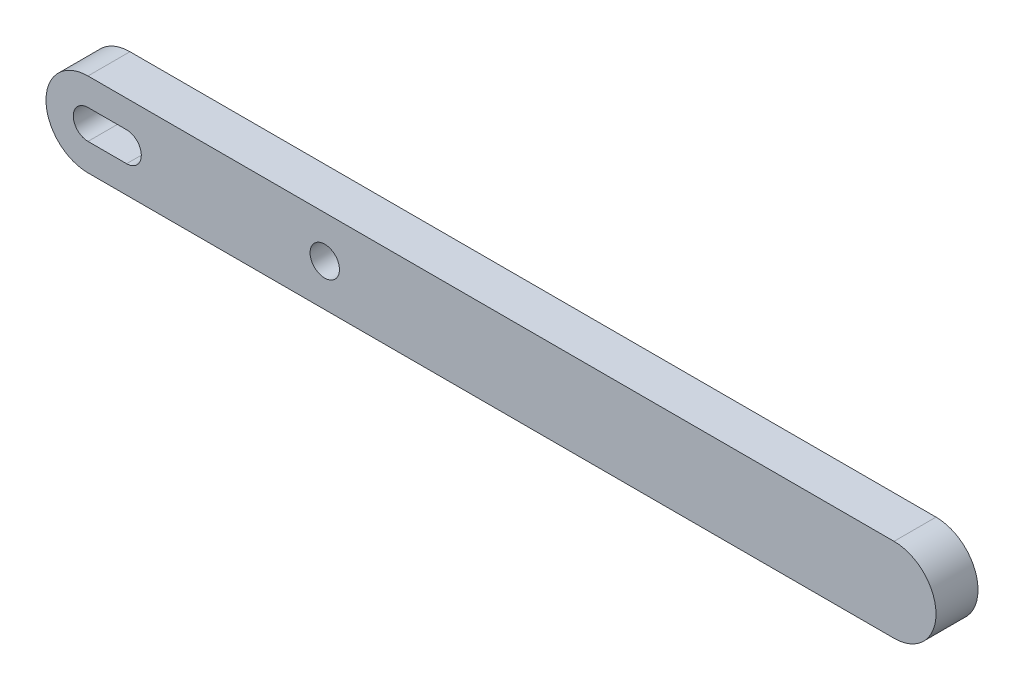
from build123d import *

# Parameters (mm, degrees)
SKETCH1_R           = 1.75
BOSS_EXTRUDE1_DEPTH = 5


with BuildPart() as part:
    # Sketch1 → Boss-Extrude1 (new body)
    with BuildSketch(Plane(origin=(0, 0, 0), x_dir=(0, 1, 0), z_dir=(0, 0, 1))):
        with BuildLine():
            Line((-5, 0), (-5, 96))
            ThreePointArc((-5, 96), (0, 101), (5, 96))
            Line((5, 96), (5, 0))
            ThreePointArc((5, 0), (0, -5), (-5, 0))
        make_face()
        with Locations(Location((0, 67.8, 0), (0, 0, 270))):
            Circle(SKETCH1_R, mode=Mode.SUBTRACT)
        with BuildLine():
            Line((1.75, 96), (1.75, 91.4))
            ThreePointArc((1.75, 91.4), (0, 89.65), (-1.75, 91.4))
            Line((-1.75, 91.4), (-1.75, 96))
            ThreePointArc((-1.75, 96), (0, 97.75), (1.75, 96))
        make_face(mode=Mode.SUBTRACT)
    extrude(amount=BOSS_EXTRUDE1_DEPTH)


solid = part.part
